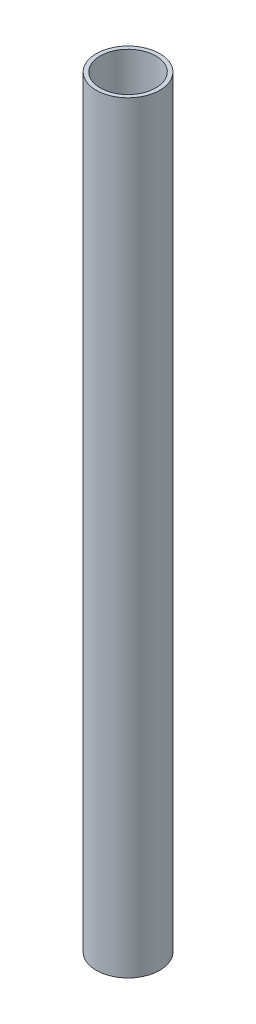
from build123d import *

# Parameters (mm, degrees)
SKETCH1_R           = 25.4
SKETCH1_R_2         = 22.225
BOSS_EXTRUDE1_DEPTH = 609.6


with BuildPart() as part:
    # Sketch1 → Boss-Extrude1 (new body)
    with BuildSketch(Plane(origin=(0, 0, 0), x_dir=(1, 0, 0), z_dir=(0, 1, 0))):
        with Locations(Location((0, 0, 0), (0, 0, 90))):
            Circle(SKETCH1_R)
        with Locations(Location((0, 0, 0), (0, 0, 90))):
            Circle(SKETCH1_R_2, mode=Mode.SUBTRACT)
    extrude(amount=BOSS_EXTRUDE1_DEPTH)


solid = part.part
